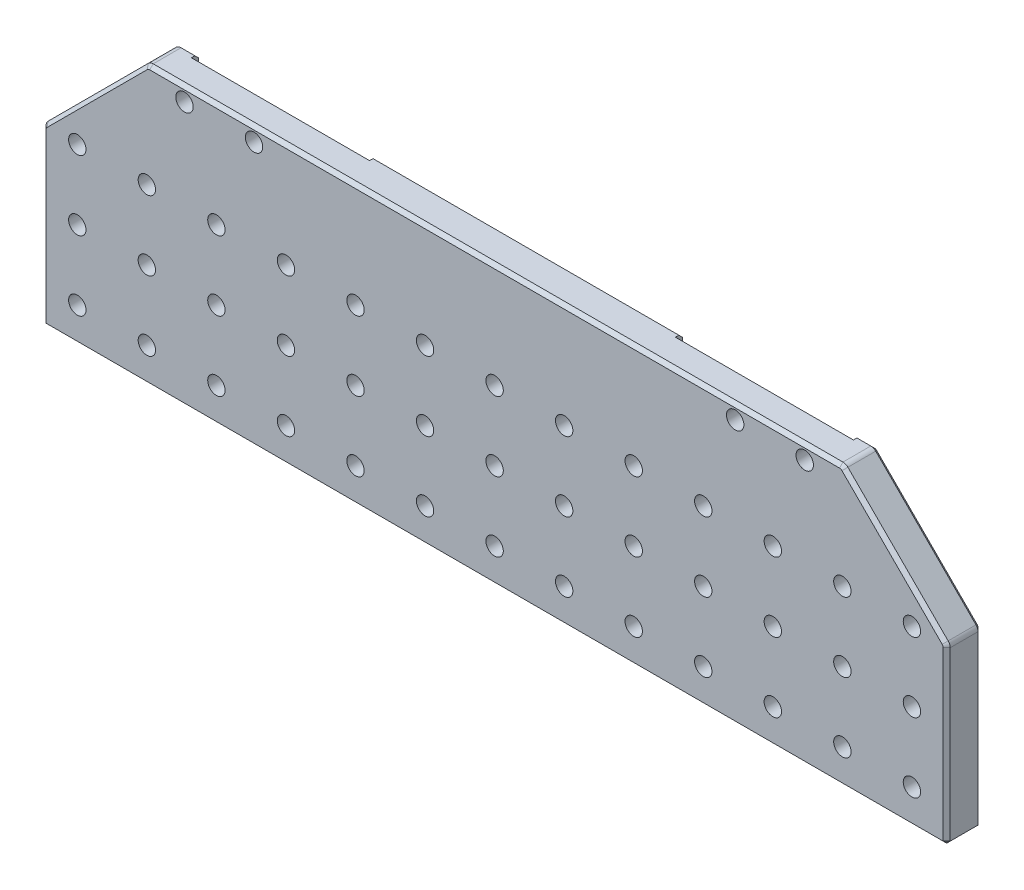
from build123d import *

# Parameters (mm, degrees)
EXTRUDE_1_DEPTH             = 4
EXTRUDE_1_DEPTH_BACK        = 1
SKETCH_2_W                  = 130
SKETCH_2_H                  = 40
SKETCH_6_W                  = 25.606106999
SKETCH_6_H                  = 5
CUT_EXTRUDE_6_DEPTH         = 1
SKETCH_7_R                  = 2.5
CUT_EXTRUDE_7_DEPTH         = 1
CHAMFER_1_SIZE              = 15
M3X0_5_1_D                  = 2.5
FILLET_1_R                  = 1
M3X0_5_2_D                  = 2.5
PATTERN_LINEAR_1_COUNT      = 7
PATTERN_LINEAR_1_PITCH      = 10
PATTERN_LINEAR_1_COUNT_DIR2 = 3
PATTERN_LINEAR_1_PITCH_DIR2 = 10
PATTERN_LINEAR_2_COUNT      = 7
PATTERN_LINEAR_2_PITCH      = 10
PATTERN_LINEAR_2_COUNT_DIR2 = 3
PATTERN_LINEAR_2_PITCH_DIR2 = 10
CHAMFER_2_SIZE              = 0.5


with BuildPart() as part:
    # ｽｹｯﾁ2 → ﾎﾞｽ - 押し出し1 (new, two sides: drawn at the far end of the back side and taken through both)
    with BuildSketch(Plane.XY.offset(-EXTRUDE_1_DEPTH_BACK)):
        with Locations((-80.49999999, -32)):
            Rectangle(SKETCH_2_W, SKETCH_2_H)
    extrude(amount=EXTRUDE_1_DEPTH + EXTRUDE_1_DEPTH_BACK)

    # ｽｹｯﾁ6 → ｶｯﾄ - 押し出し6 (cut)
    with BuildSketch(Plane(origin=(0, 0, -1), x_dir=(-1, 0, 0), z_dir=(0, 0, -1))):
        with Locations((115.285099269, -14.5)):
            Rectangle(SKETCH_6_W, SKETCH_6_H)
        with Locations((45.714900713, -14.5)):
            Rectangle(SKETCH_6_W, SKETCH_6_H)
    extrude(amount=-CUT_EXTRUDE_6_DEPTH, mode=Mode.SUBTRACT)

    # ｽｹｯﾁ7 → ｶｯﾄ - 押し出し7 (cut)
    with BuildSketch(Plane(origin=(0, 0, -1), x_dir=(-1, 0, 0), z_dir=(0, 0, -1))):
        with Locations((33.318100992, -17)):
            Circle(SKETCH_7_R)
        with Locations((128.088152768, -17)):
            Circle(SKETCH_7_R)
        with Locations((102.482045769, -17)):
            Circle(SKETCH_7_R)
        with Locations((58.517954212, -17)):
            Circle(SKETCH_7_R)
    extrude(amount=-CUT_EXTRUDE_7_DEPTH, mode=Mode.SUBTRACT)

    # 面取り1
    chamfer_1_edges = [part.edges().sort_by_distance(p)[0] for p in [
        (-145.49999999, -12, 1.5),
        (-15.49999999, -12, 1.5),
    ]]
    chamfer(chamfer_1_edges, length=CHAMFER_1_SIZE)

    # M3x0.5 ねじ穴1 (through all)
    with Locations(Plane(origin=(0, 0, 0), x_dir=(-1, 0, 0), z_dir=(0, 0, -1))):
        with Locations((35.911847213, -14), (125.088152768, -14), (45.911847213, -14), (115.088152768, -14)):
            Hole(M3X0_5_1_D / 2)

    # ﾌｨﾚｯﾄ1
    fillet_1_edges = [part.edges().sort_by_distance(p)[0] for p in [
        (-145.49999999, -27, 1.5),
        (-130.49999999, -12, 1.5),
        (-30.49999999, -12, 1.5),
        (-15.49999999, -27, 1.5),
    ]]
    fillet(fillet_1_edges, radius=FILLET_1_R)

    # M3x0.5 ねじ穴2 (through all)
    with Locations(Plane(origin=(0, 0, -1), x_dir=(-1, 0, 0), z_dir=(0, 0, -1))):
        with Locations((80.49999999, -47)):
            m3x0_5_2 = Hole(M3X0_5_2_D / 2)

    # 直線ﾊﾟﾀｰﾝ1: M3x0.5 _2 7 × 3
    with Locations(*[(i * PATTERN_LINEAR_1_PITCH, j * PATTERN_LINEAR_1_PITCH_DIR2, 0) for i in range(PATTERN_LINEAR_1_COUNT) for j in range(PATTERN_LINEAR_1_COUNT_DIR2) if (i, j) != (0, 0)]):
        add(m3x0_5_2, mode=Mode.SUBTRACT)

    # 直線ﾊﾟﾀｰﾝ2: M3x0.5 _2 7 × 3
    with Locations(*[(-i * PATTERN_LINEAR_2_PITCH, j * PATTERN_LINEAR_2_PITCH_DIR2, 0) for i in range(PATTERN_LINEAR_2_COUNT) for j in range(PATTERN_LINEAR_2_COUNT_DIR2) if (i, j) != (0, 0)]):
        add(m3x0_5_2, mode=Mode.SUBTRACT)

    # 面取り2
    chamfer_2_edges = [part.edges().sort_by_distance(p)[0] for p in [
        (-80.49999999, -12, -1),
        (-129.086969598, -12, -1),
        (-31.913030383, -12, -1),
        (-30.53153012, -12.076120467, 4),
        (-130.46846986, -12.076120467, 4),
        (-130.46846986, -12.076120467, -1),
        (-30.53153012, -12.076120467, -1),
        (-22.99999999, -19.5, 4),
        (-137.99999999, -19.5, 4),
        (-137.99999999, -19.5, -1),
        (-22.99999999, -19.5, -1),
        (-15.576120458, -27.03153013, 4),
        (-145.423879523, -27.03153013, 4),
        (-145.423879523, -27.03153013, -1),
        (-15.576120458, -27.03153013, -1),
        (-15.49999999, -39.707106781, 4),
        (-145.49999999, -39.707106781, 4),
        (-80.49999999, -52, 4),
        (-145.49999999, -52, 1.5),
        (-15.49999999, -52, 1.5),
        (-145.49999999, -39.707106781, -1),
        (-80.49999999, -52, -1),
        (-15.49999999, -39.707106781, -1),
        (-80.49999999, -12, 4),
    ]]
    chamfer(chamfer_2_edges, length=CHAMFER_2_SIZE)


solid = part.part
